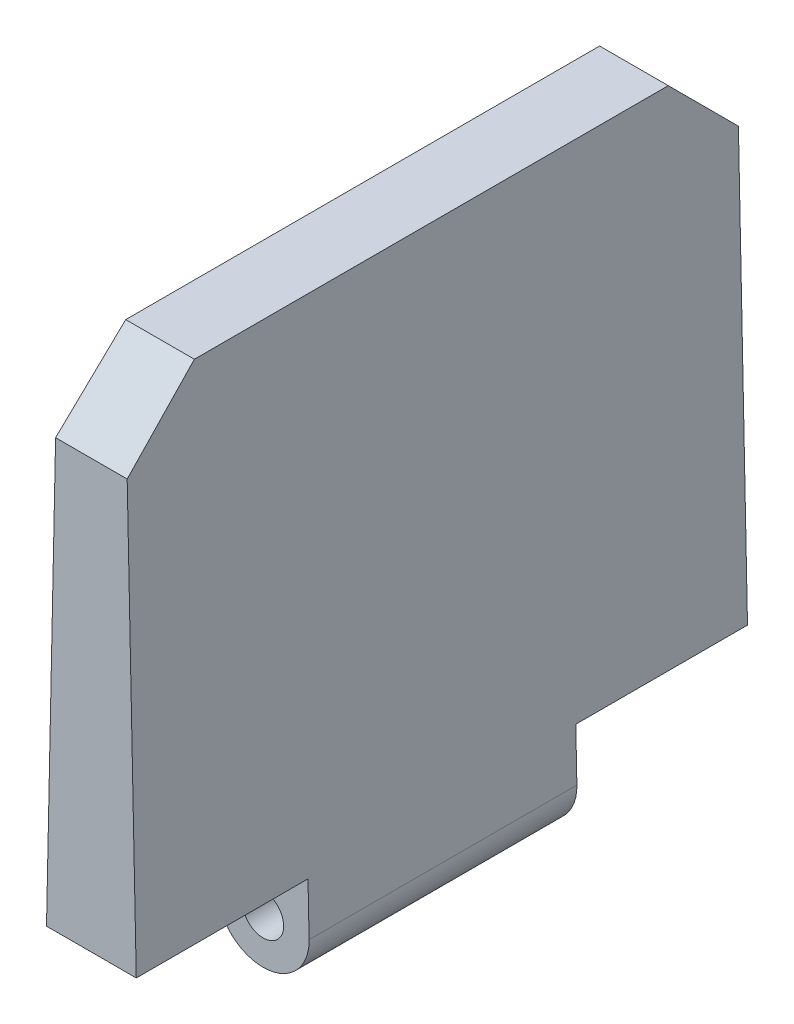
from build123d import *

# Parameters (mm, degrees)
EXTRUDE1_DEPTH      = 22.61
CHAMFER1_SIZE       = 2.54
SKETCH2_R           = 0.76
CUT_EXTRUDE1_DEPTH  = 31.446849151
EXTRUDE2_DEPTH      = 31.446849151
EXTRUDE2_DEPTH_BACK = 31.446849151
SKETCH3_W           = 6.352
SKETCH3_H           = 3.664879672


with BuildPart() as part:
    # Sketch1 → Extrude1 (new body)
    with BuildSketch(Plane.XY):
        with BuildLine():
            Line((-1.27, 20.32), (-1.701415211, 0.036187299))
            ThreePointArc((-1.701415211, 0.036187299), (0, -1.7018), (1.701415211, 0.036187299))
            Line((1.701415211, 0.036187299), (1.27, 20.32))
            Line((1.27, 20.32), (-1.27, 20.32))
        make_face()
    extrude(amount=-EXTRUDE1_DEPTH)

    # Chamfer1
    chamfer1_edges = [part.edges().sort_by_distance(p)[0] for p in [
        (0, 20.32, -22.61),
        (0, 20.32, 0),
    ]]
    chamfer(chamfer1_edges, length=CHAMFER1_SIZE)

    # Sketch2 → Cut-Extrude1 (cut, through all)
    with BuildSketch(Plane.XY):
        Circle(SKETCH2_R)
    extrude(amount=-CUT_EXTRUDE1_DEPTH, mode=Mode.SUBTRACT)

    # Sketch3 → Extrude2 (cut, two sides: drawn at the far end of the back side and taken through both)
    with BuildSketch(Plane(origin=(0, 0, 0), x_dir=(0, 0, -1), z_dir=(1, 0, 0)).offset(-EXTRUDE2_DEPTH_BACK)):
        with Locations((3.176, 0.130639836)):
            Rectangle(SKETCH3_W, SKETCH3_H)
        with Locations((19.434, 0.130639836)):
            Rectangle(SKETCH3_W, SKETCH3_H)
    extrude(amount=EXTRUDE2_DEPTH + EXTRUDE2_DEPTH_BACK, mode=Mode.SUBTRACT)


solid = part.part
